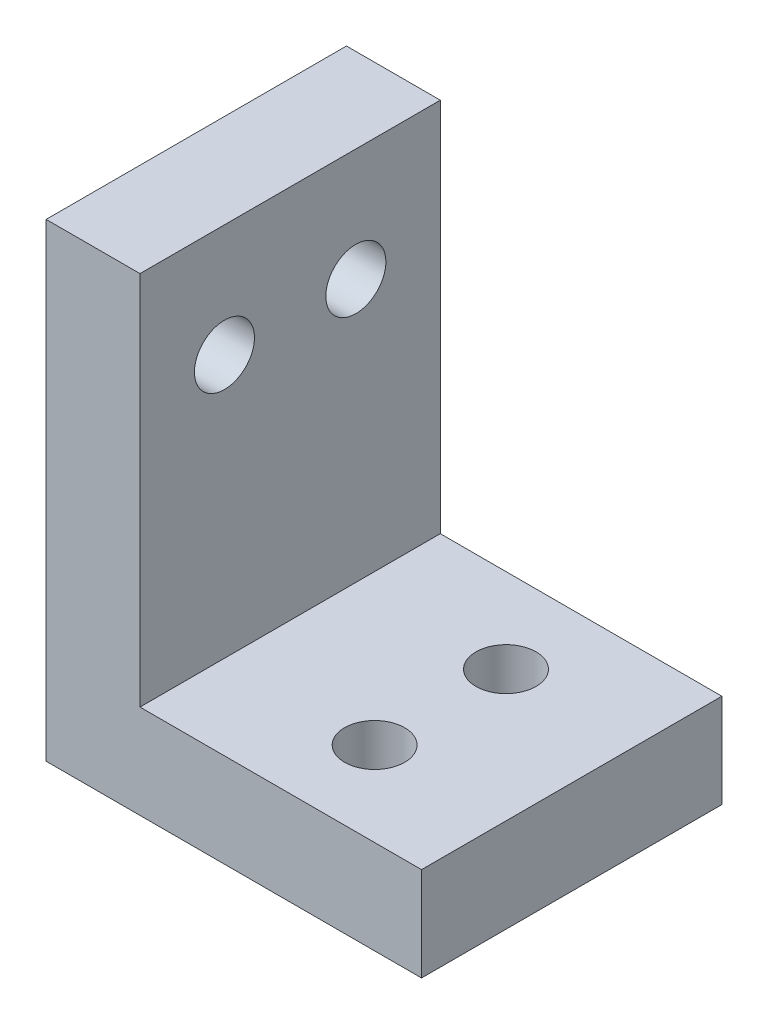
from build123d import *

# Parameters (mm, degrees)
EXTRUDE_1_DEPTH     = 16
SKETCH_4_R          = 1.6
CUT_EXTRUDE_3_DEPTH = 38
SKETCH_5_R          = 1.6
CUT_EXTRUDE_4_DEPTH = 38


with BuildPart() as part:
    # 草图1 → 凸台-拉伸1 (new body)
    with BuildSketch(Plane.XY):
        Polygon((0, 25), (0, 0), (20, 0), (20, 5), (5, 5), (5, 25), align=None)
    extrude(amount=EXTRUDE_1_DEPTH)

    # 草图4 → 切除-拉伸3 (cut)
    with BuildSketch(Plane(origin=(0, 5, 0), x_dir=(1, 0, 0), z_dir=(0, 1, 0))):
        with Locations(Location((13, -4.5, 0), (0, 0, 180))):
            Circle(SKETCH_4_R)
        with Locations(Location((13, -11.5, 0), (0, 0, 180))):
            Circle(SKETCH_4_R)
    extrude(amount=-CUT_EXTRUDE_3_DEPTH, mode=Mode.SUBTRACT)

    # 草图5 → 切除-拉伸4 (cut)
    with BuildSketch(Plane.ZY):
        with Locations(Location((4.5, 19, 0), (0, 0, 270))):
            Circle(SKETCH_5_R)
        with Locations(Location((11.5, 19, 0), (0, 0, 270))):
            Circle(SKETCH_5_R)
    extrude(amount=-CUT_EXTRUDE_4_DEPTH, mode=Mode.SUBTRACT)


solid = part.part
